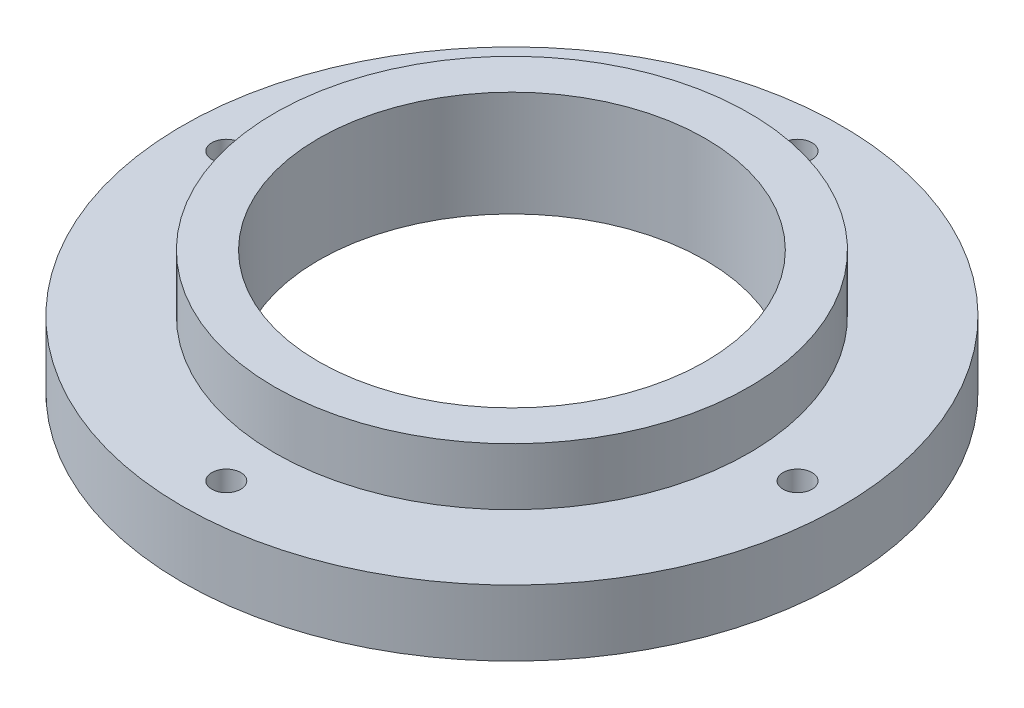
from build123d import *

# Parameters (mm, degrees)
SKIZZE1_R                       = 37.5
SKIZZE1_R_2                     = 22
AUFSATZ_LINEAR_AUSTRAGEN1_DEPTH = 14
SCHNITT_LINEAR_START            = -6.5
SKIZZE2_R                       = 37.5
SKIZZE2_R_2                     = 27
SCHNITT_LINEAR_AUSTRAGEN1_DEPTH = 6.5
M4X0_7_GEWINDEBOHRUNG1_D        = 3.3
SKIZZE5_R                       = 26.5
SCHNITT_LINEAR_AUSTRAGEN2_DEPTH = 2


with BuildPart() as part:
    # Skizze1 → Aufsatz-Linear austragen1 (new body)
    with BuildSketch(Plane(origin=(0, 0, 0), x_dir=(1, 0, 0), z_dir=(0, 1, 0))):
        with Locations(Location((0, 0, 0), (0, 0, 270))):
            Circle(SKIZZE1_R)
        with Locations(Location((0, 0, 0), (0, 0, 270))):
            Circle(SKIZZE1_R_2, mode=Mode.SUBTRACT)
    extrude(amount=AUFSATZ_LINEAR_AUSTRAGEN1_DEPTH)

    # Skizze2 → Schnitt-Linear austragen1 (cut)
    with BuildSketch(Plane(origin=(0, 14, 0), x_dir=(1, 0, 0), z_dir=(0, 1, 0)).offset(SCHNITT_LINEAR_START)):
        with Locations(Location((0, 0, 0), (0, 0, 270))):
            Circle(SKIZZE2_R)
        with Locations(Location((0, 0, 0), (0, 0, 270))):
            Circle(SKIZZE2_R_2, mode=Mode.SUBTRACT)
    extrude(amount=SCHNITT_LINEAR_AUSTRAGEN1_DEPTH, mode=Mode.SUBTRACT)

    # M4x0.7 Gewindebohrung1 (through all)
    with Locations(Plane(origin=(0, 7.5, 0), x_dir=(1, 0, 0), z_dir=(0, 1, 0))):
        with Locations((-32.5, 0), (0, 32.5), (0, -32.5), (32.5, 0)):
            Hole(M4X0_7_GEWINDEBOHRUNG1_D / 2)

    # Skizze5 → Schnitt-Linear austragen2 (cut)
    with BuildSketch(Plane.XZ):
        with Locations(Location((0, 0, 0), (0, 0, 270))):
            Circle(SKIZZE5_R)
    extrude(amount=-SCHNITT_LINEAR_AUSTRAGEN2_DEPTH, mode=Mode.SUBTRACT)


solid = part.part
